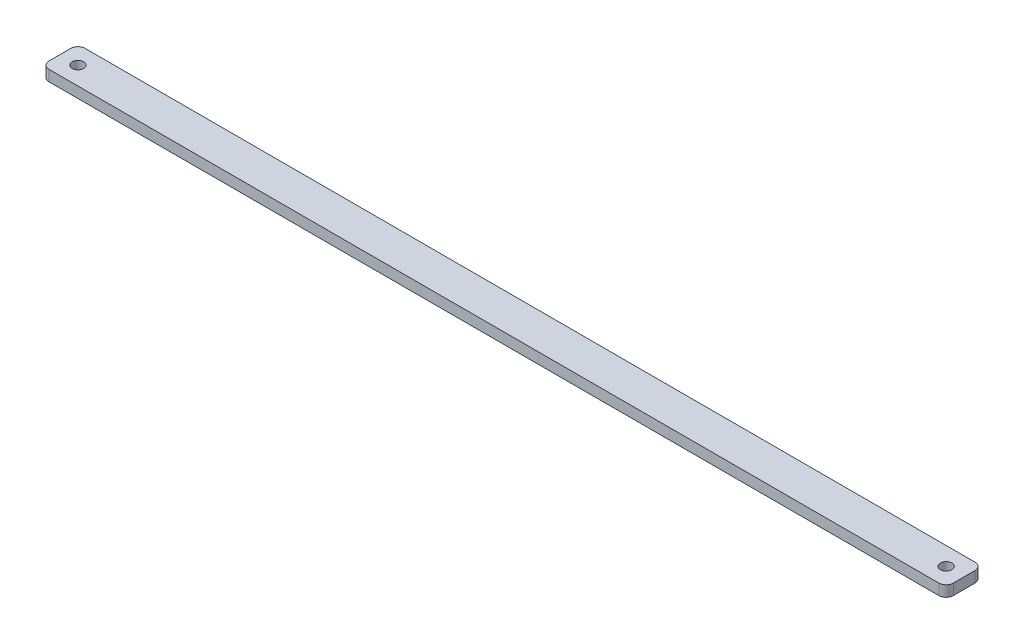
from build123d import *

# Parameters (mm, degrees)
SKETCH_1_W      = 250
SKETCH_1_H      = 10
SKETCH_1_R      = 1.6
EXTRUDE_1_DEPTH = 3
FILLET_2_R      = 2
FILLET_3_R      = 2


with BuildPart() as part:
    # 草图1 → 凸台-拉伸1 (new body)
    with BuildSketch(Plane(origin=(0, 0, 0), x_dir=(1, 0, 0), z_dir=(0, 1, 0))):
        Rectangle(SKETCH_1_W, SKETCH_1_H)
        with Locations(Location((-120, 0, 0), (0, 0, 270))):
            Circle(SKETCH_1_R, mode=Mode.SUBTRACT)
        with Locations(Location((120, 0, 0), (0, 0, 270))):
            Circle(SKETCH_1_R, mode=Mode.SUBTRACT)
    extrude(amount=EXTRUDE_1_DEPTH)

    # 圆角2
    fillet_2_edges = [part.edges().sort_by_distance(p)[0] for p in [
        (-125, 1.5, 5),
    ]]
    fillet(fillet_2_edges, radius=FILLET_2_R)

    # 圆角3
    fillet_3_edges = [part.edges().sort_by_distance(p)[0] for p in [
        (125, 1.5, 5),
        (-125, 1.5, -5),
        (125, 1.5, -5),
    ]]
    fillet(fillet_3_edges, radius=FILLET_3_R)


solid = part.part
